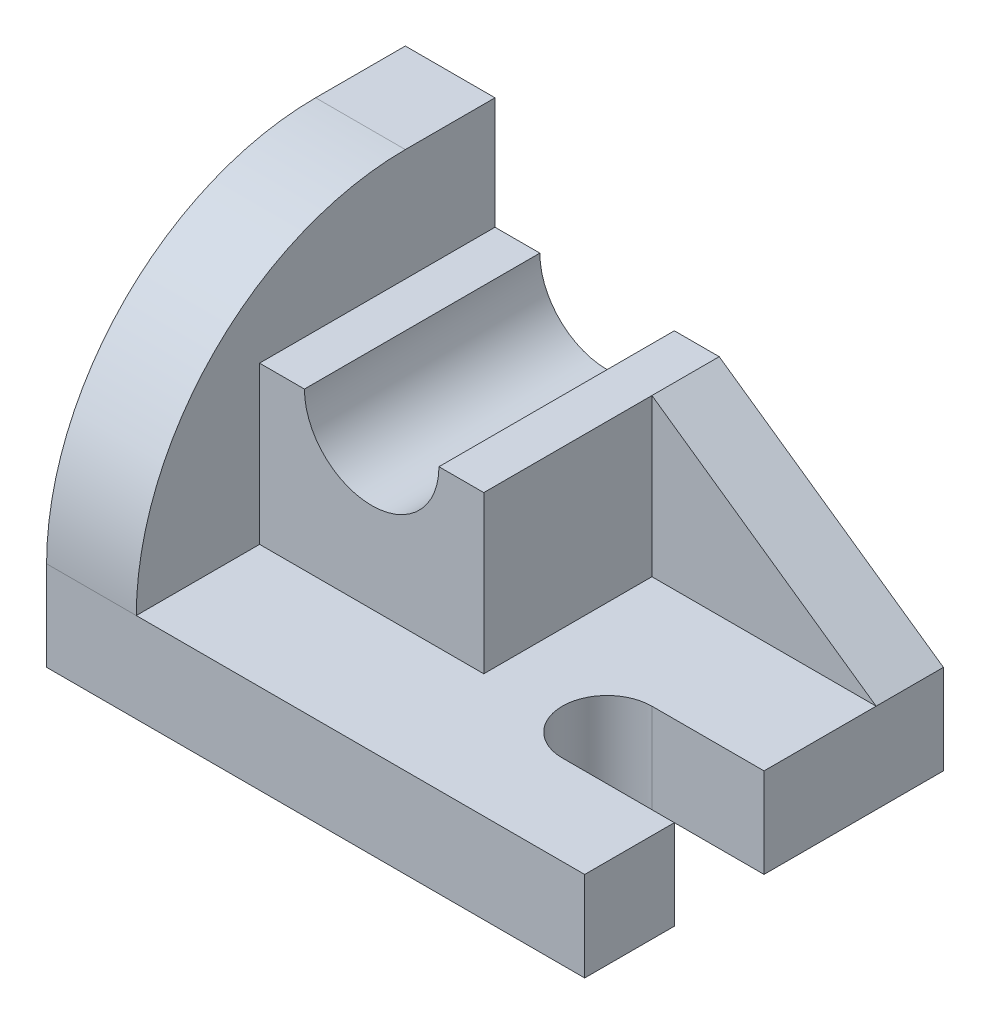
from build123d import *

# Parameters (mm, degrees)
SKETCH1_W               = 96
SKETCH1_H               = 64
BOSS_EXTRUDE1_DEPTH     = 16
SKETCH2_W               = 16
SKETCH2_H               = 64
BOSS_EXTRUDE2_DEPTH     = 48
FILLET1_R               = 48
CUT_EXTRUDE3_DEPTH      = 16
SKETCH4_W               = 40
SKETCH4_H               = 42
BOSS_EXTRUDE3_DEPTH     = 28
CUT_EXTRUDE5_DEPTH      = 90.403692686
CUT_EXTRUDE5_DEPTH_BACK = 90.403692686
SKETCH6_R               = 12
SKETCH10_W              = 40
SKETCH10_H              = 12
BOSS_EXTRUDE4_DEPTH     = 44
CUT_EXTRUDE6_DEPTH      = 44


with BuildPart() as part:
    # Sketch1 → Boss-Extrude1 (new body)
    with BuildSketch(Plane(origin=(0, 0, 0), x_dir=(1, 0, 0), z_dir=(0, 1, 0))):
        with Locations((1.242718447, -6.368932039)):
            Rectangle(SKETCH1_W, SKETCH1_H)
    extrude(amount=BOSS_EXTRUDE1_DEPTH)

    # Sketch2 → Boss-Extrude2 (add)
    with BuildSketch(Plane(origin=(0, 16, 0), x_dir=(1, 0, 0), z_dir=(0, 1, 0))):
        with Locations((-38.757281553, -6.368932039)):
            Rectangle(SKETCH2_W, SKETCH2_H)
    extrude(amount=BOSS_EXTRUDE2_DEPTH)

    # Fillet1
    fillet1_edges = [part.edges().sort_by_distance(p)[0] for p in [
        (-38.757281553, 64, 38.368932039),
    ]]
    fillet(fillet1_edges, radius=FILLET1_R)

    # Sketch3 → Cut-Extrude3 (cut)
    with BuildSketch(Plane(origin=(0, 16, 0), x_dir=(1, 0, 0), z_dir=(0, 1, 0))):
        with BuildLine():
            Line((49.242718447, -6.368932039), (29.242718447, -6.368932039))
            ThreePointArc((29.242718447, -6.368932039), (21.242718447, -14.368932039), (29.242718447, -22.368932039))
            Line((29.242718447, -22.368932039), (49.242718447, -22.368932039))
            Line((49.242718447, -22.368932039), (49.242718447, -6.368932039))
        make_face()
    extrude(amount=-CUT_EXTRUDE3_DEPTH, mode=Mode.SUBTRACT)

    # Sketch4 → Boss-Extrude3 (add)
    with BuildSketch(Plane(origin=(0, 16, 0), x_dir=(1, 0, 0), z_dir=(0, 1, 0))):
        with Locations((-10.757281553, 4.631067961)):
            Rectangle(SKETCH4_W, SKETCH4_H)
    extrude(amount=BOSS_EXTRUDE3_DEPTH)

    # Sketch6 → Cut-Extrude5 (cut, two sides: drawn at the far end of the back side and taken through both)
    with BuildSketch(Plane.XY.offset(-CUT_EXTRUDE5_DEPTH_BACK)):
        with Locations((-10.757281553, 44)):
            Circle(SKETCH6_R)
    extrude(amount=CUT_EXTRUDE5_DEPTH + CUT_EXTRUDE5_DEPTH_BACK, mode=Mode.SUBTRACT)

    # Sketch10 → Boss-Extrude4 (add)
    with BuildSketch(Plane(origin=(0, 0, 0), x_dir=(1, 0, 0), z_dir=(0, 1, 0))):
        with Locations((29.242718447, 19.631067961)):
            Rectangle(SKETCH10_W, SKETCH10_H)
    extrude(amount=BOSS_EXTRUDE4_DEPTH)

    # Sketch11 → Cut-Extrude6 (cut)
    with BuildSketch(Plane.XY.offset(-13.631067961)):
        Polygon((9.242718447, 44), (49.242718447, 16), (49.242718447, 44), align=None)
    extrude(amount=-CUT_EXTRUDE6_DEPTH, mode=Mode.SUBTRACT)


solid = part.part
